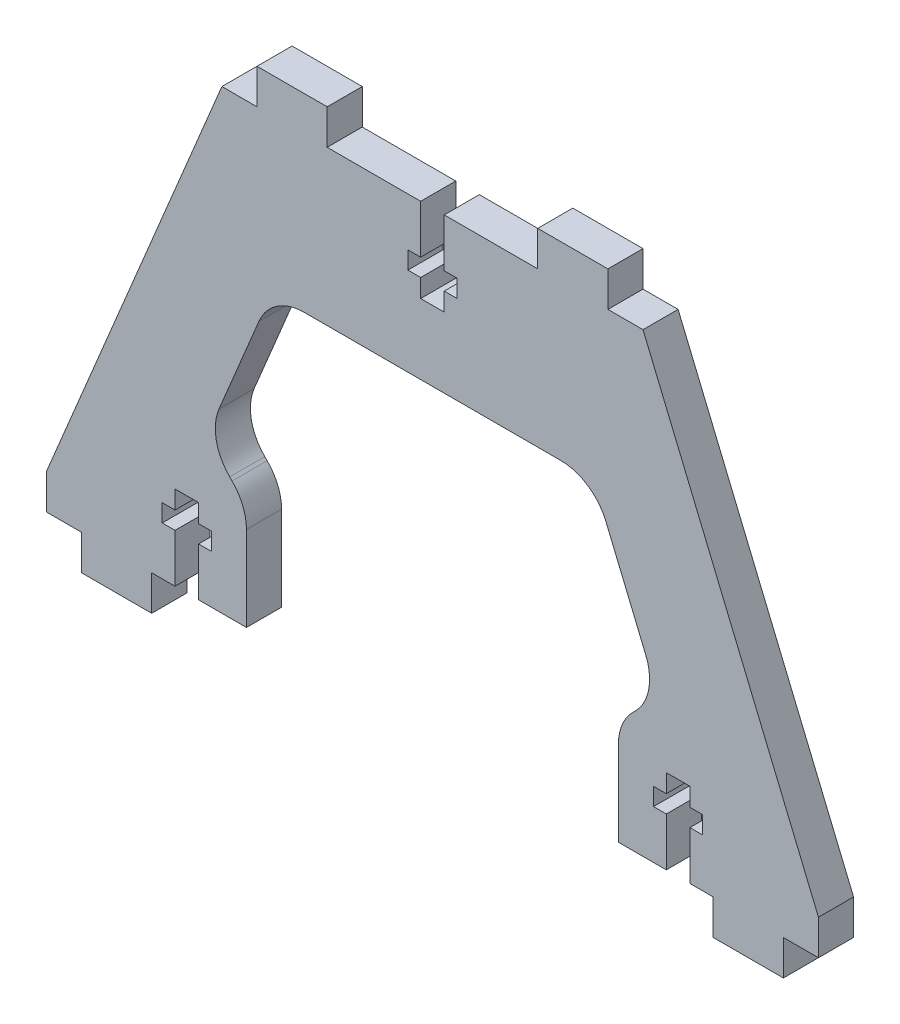
from build123d import *

# Parameters (mm, degrees)
SKETCH1_W               = 139.7
SKETCH1_H               = 82.55
BOSS_EXTRUDE1_DEPTH     = 6.35
SKETCH2_W               = 12.7
SKETCH2_H               = 6.35
BOSS_EXTRUDE2_DEPTH     = 6.35
CUT_EXTRUDE1_DEPTH      = 6.35
CUT_EXTRUDE8_DEPTH      = 6.35
CUT_EXTRUDE2_DEPTH      = 6.35
CUT_EXTRUDE9_DEPTH      = 85.77904001
CUT_EXTRUDE9_DEPTH_BACK = 85.77904001
FILLET1_R               = 8.89


with BuildPart() as part:
    # Sketch1 → Boss-Extrude1 (new body)
    with BuildSketch(Plane.XY):
        Rectangle(SKETCH1_W, SKETCH1_H)
    extrude(amount=BOSS_EXTRUDE1_DEPTH)

    # Sketch2 → Boss-Extrude2 (add)
    with BuildSketch(Plane(origin=(0, 0, 0), x_dir=(-1, 0, 0), z_dir=(0, 0, -1))):
        with Locations((-57.15, -44.45)):
            Rectangle(SKETCH2_W, SKETCH2_H)
        with Locations((-25.4, 44.45)):
            Rectangle(SKETCH2_W, SKETCH2_H)
    boss_extrude2 = extrude(amount=-BOSS_EXTRUDE2_DEPTH)

    # Sketch3 → Cut-Extrude1 (cut)
    with BuildSketch(Plane(origin=(0, 0, 0), x_dir=(-1, 0, 0), z_dir=(0, 0, -1))):
        Polygon((-46.5836, -41.275), (-46.5836, -32.512), (-48.895, -32.512), (-48.895, -29.337), (-46.5836, -29.337), (-46.5836, -26.035), (-42.3164, -26.035), (-42.3164, -29.337), (-40.005, -29.337), (-40.005, -32.512), (-42.3164, -32.512), (-42.3164, -41.275), align=None)
    cut_extrude1 = extrude(amount=-CUT_EXTRUDE1_DEPTH, mode=Mode.SUBTRACT)

    # Sketch7 → Cut-Extrude8 (cut)
    with BuildSketch(Plane(origin=(0, 0, 0), x_dir=(-1, 0, 0), z_dir=(0, 0, -1))):
        Polygon((-38.1, 41.275), (-69.85, -34.925), (-69.85, 41.275), align=None)
    cut_extrude8 = extrude(amount=-CUT_EXTRUDE8_DEPTH, mode=Mode.SUBTRACT)

    # Mirror2: Boss-Extrude2, Cut-Extrude8 across plane
    add(boss_extrude2.mirror(Plane(origin=(0, 0, 0), x_dir=(0, 0, 1), z_dir=(1, 0, 0))))
    add(cut_extrude8.mirror(Plane(origin=(0, 0, 0), x_dir=(0, 0, 1), z_dir=(1, 0, 0))), mode=Mode.SUBTRACT)

    # Mirror4: Cut-Extrude1 across plane
    add(cut_extrude1.mirror(Plane(origin=(0, 0, 0), x_dir=(0, 0, 1), z_dir=(1, 0, 0))), mode=Mode.SUBTRACT)

    # Sketch4 → Cut-Extrude2 (cut)
    with BuildSketch(Plane(origin=(0, 0, 0), x_dir=(-1, 0, 0), z_dir=(0, 0, -1))):
        Polygon((2.1336, 41.275), (-2.1336, 41.275), (-2.1336, 32.512), (-4.445, 32.512), (-4.445, 29.337), (-2.1336, 29.337), (-2.1336, 26.035), (2.1336, 26.035), (2.1336, 29.337), (4.445, 29.337), (4.445, 32.512), (2.1336, 32.512), align=None)
    extrude(amount=-CUT_EXTRUDE2_DEPTH, mode=Mode.SUBTRACT)

    # Sketch8 → Cut-Extrude9 (cut, two sides: drawn at the far end of the back side and taken through both)
    with BuildSketch(Plane.XY.offset(6.35).offset(-CUT_EXTRUDE9_DEPTH_BACK)):
        Polygon((-33.655, -22.225), (-40.901470588, -14.978529412), (-29.104166667, 13.335), (29.104166667, 13.335), (40.901470588, -14.978529412), (33.655, -22.225), (33.655, -41.275), (-33.655, -41.275), align=None)
    extrude(amount=CUT_EXTRUDE9_DEPTH + CUT_EXTRUDE9_DEPTH_BACK, mode=Mode.SUBTRACT)

    # Fillet1
    fillet1_edges = [part.edges().sort_by_distance(p)[0] for p in [
        (-33.655, -22.225, 3.175),
        (-40.901470588, -14.978529412, 3.175),
        (-29.104166667, 13.335, 3.175),
        (29.104166667, 13.335, 3.175),
        (40.901470588, -14.978529412, 3.175),
        (33.655, -22.225, 3.175),
    ]]
    fillet(fillet1_edges, radius=FILLET1_R)


solid = part.part
